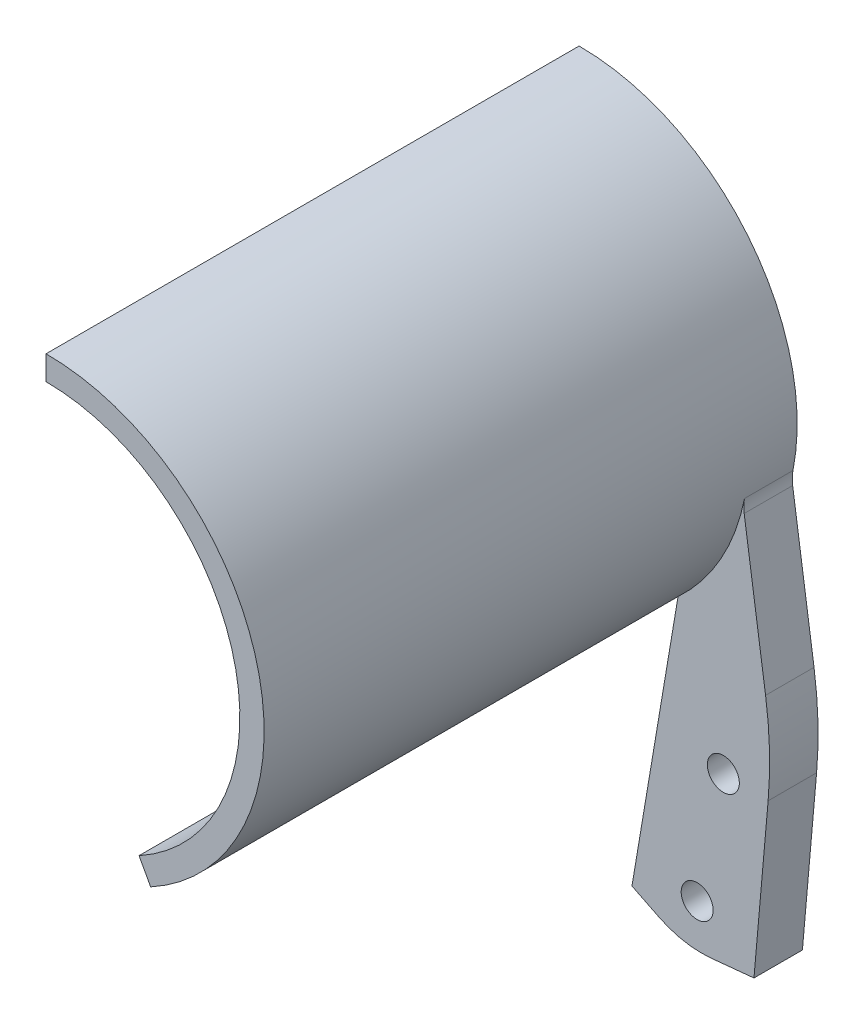
from build123d import *

# Parameters (mm, degrees)
SKETCH_1_R      = 1.65
EXTRUDE_1_DEPTH = 5
FILLET_2_R      = 4
FILLET_3_R      = 40
FILLET_4_R      = 10
EXTRUDE_2_DEPTH = 55


with BuildPart() as part:
    # 草图1 → 凸台-拉伸1 (new body)
    with BuildSketch(Plane.XY):
        with BuildLine():
            Line((-11.5, 79.5), (-11.5, 82))
            ThreePointArc((-11.5, 82), (6.103622298, 73.512939805), (10.426977744, 54.454442843))
            Line((10.426977744, 54.454442843), (13.41461423, 33.96926032))
            Line((13.41461423, 33.96926032), (11.539893904, 12.741041785))
            Line((11.539893904, 12.741041785), (4.278741136, 12.025251419))
            Line((4.278741136, 12.025251419), (-1.047111461, 14.664575003))
            Line((-1.047111461, 14.664575003), (3.709660575, 42.919402146))
            ThreePointArc((3.709660575, 42.919402146), (1.596827744, 41.204560595), (-0.707567867, 39.757320125))
            Line((-0.707567867, 39.757320125), (-1.906726993, 41.950951222))
            ThreePointArc((-1.906726993, 41.950951222), (7.877576933, 64.450708254), (-11.5, 79.5))
        make_face()
        with Locations((5.679475492, 16.683750627)):
            Circle(SKETCH_1_R, mode=Mode.SUBTRACT)
        with Locations((8.382327473, 29.399669437)):
            Circle(SKETCH_1_R, mode=Mode.SUBTRACT)
    extrude(amount=EXTRUDE_1_DEPTH)

    # 圆角2
    fillet_2_edges = [part.edges().sort_by_distance(p)[0] for p in [
        (10.426977744, 54.454442843, 2.5),
    ]]
    fillet(fillet_2_edges, radius=FILLET_2_R)

    # 圆角3
    fillet_3_edges = [part.edges().sort_by_distance(p)[0] for p in [
        (13.41461423, 33.96926032, 2.5),
    ]]
    fillet(fillet_3_edges, radius=FILLET_3_R)

    # 圆角4
    fillet_4_edges = [part.edges().sort_by_distance(p)[0] for p in [
        (4.278741136, 12.025251419, 2.5),
    ]]
    fillet(fillet_4_edges, radius=FILLET_4_R)

    # 草图2 → 凸台-拉伸2 (add)
    with BuildSketch(Plane(origin=(0, 0, 0), x_dir=(-1, 0, 0), z_dir=(0, 0, -1))):
        with BuildLine():
            Line((11.5, 82), (11.5, 79.5))
            ThreePointArc((11.5, 79.5), (-7.877576933, 64.450708254), (1.906726993, 41.950951222))
            Line((1.906726993, 41.950951222), (0.707567867, 39.757320125))
            ThreePointArc((0.707567867, 39.757320125), (-10.299774049, 65.069546786), (11.5, 82))
        make_face()
    extrude(amount=-EXTRUDE_2_DEPTH)


solid = part.part
